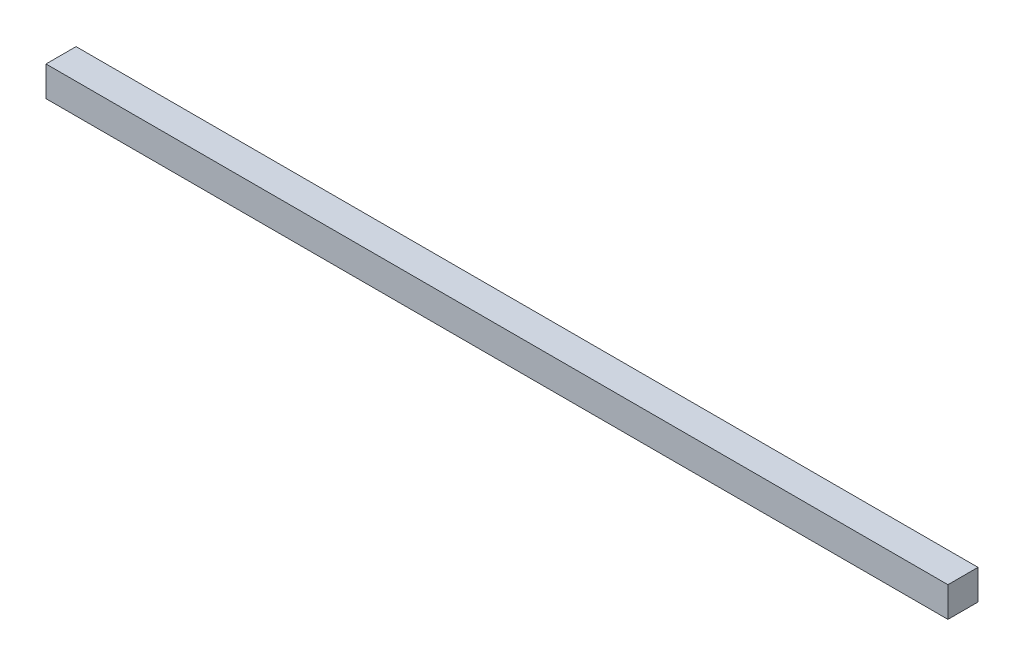
from build123d import *

# Parameters (mm, degrees)
CROQUIS1_W              = 90
CROQUIS1_H              = 3
SALIENTE_EXTRUIR1_DEPTH = 3


with BuildPart() as part:
    # Croquis1 → Saliente-Extruir1 (new body)
    with BuildSketch(Plane.XY):
        with Locations((-56.785035475, 18.171179884)):
            Rectangle(CROQUIS1_W, CROQUIS1_H)
    extrude(amount=SALIENTE_EXTRUIR1_DEPTH)


solid = part.part
